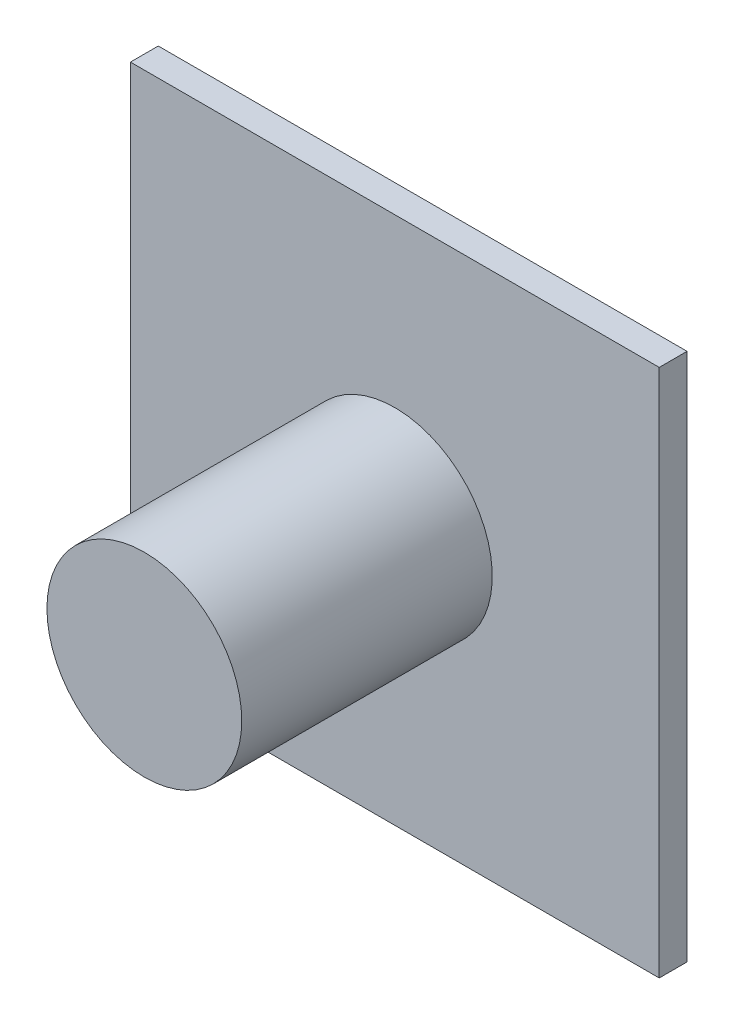
from build123d import *

# Parameters (mm, degrees)
SKETCH1_W           = 38
SKETCH1_H           = 38
BOSS_EXTRUDE1_DEPTH = 2
SKETCH2_R           = 7
BOSS_EXTRUDE2_DEPTH = 20


with BuildPart() as part:
    # Sketch1 → Boss-Extrude1 (new body)
    with BuildSketch(Plane.XY):
        Rectangle(SKETCH1_W, SKETCH1_H)
    extrude(amount=BOSS_EXTRUDE1_DEPTH)

    # Sketch2 → Boss-Extrude2 (add)
    with BuildSketch(Plane.XY):
        with Locations(Location((0, 0, 0), (0, 0, 180))):
            Circle(SKETCH2_R)
    extrude(amount=BOSS_EXTRUDE2_DEPTH)


solid = part.part
